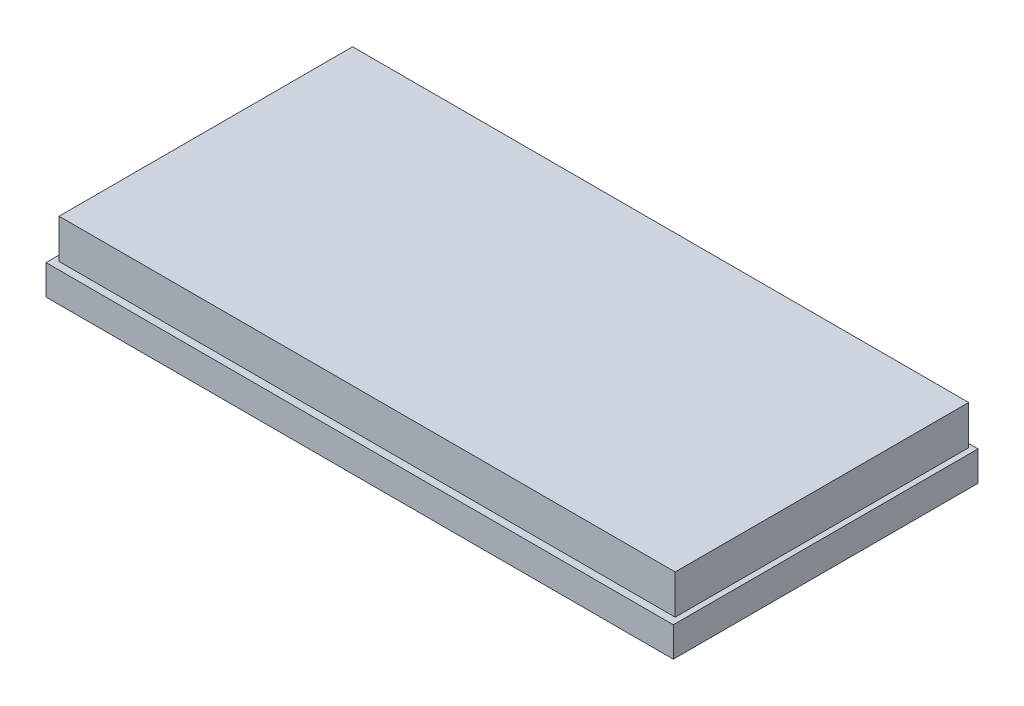
from build123d import *

# Parameters (mm, degrees)
SKETCH1_W           = 165
SKETCH1_H           = 78.6
BOSS_EXTRUDE1_DEPTH = 10.5
SKETCH2_W           = 168
SKETCH2_H           = 81.6
BOSS_EXTRUDE2_DEPTH = 8


with BuildPart() as part:
    # Sketch1 → Boss-Extrude1 (new body)
    with BuildSketch(Plane(origin=(0, 0, 0), x_dir=(1, 0, 0), z_dir=(0, 1, 0))):
        Rectangle(SKETCH1_W, SKETCH1_H)
    extrude(amount=BOSS_EXTRUDE1_DEPTH)

    # Sketch2 → Boss-Extrude2 (add)
    with BuildSketch(Plane.XZ):
        with Locations((0, 0.5)):
            Rectangle(SKETCH2_W, SKETCH2_H)
    extrude(amount=BOSS_EXTRUDE2_DEPTH)


solid = part.part
